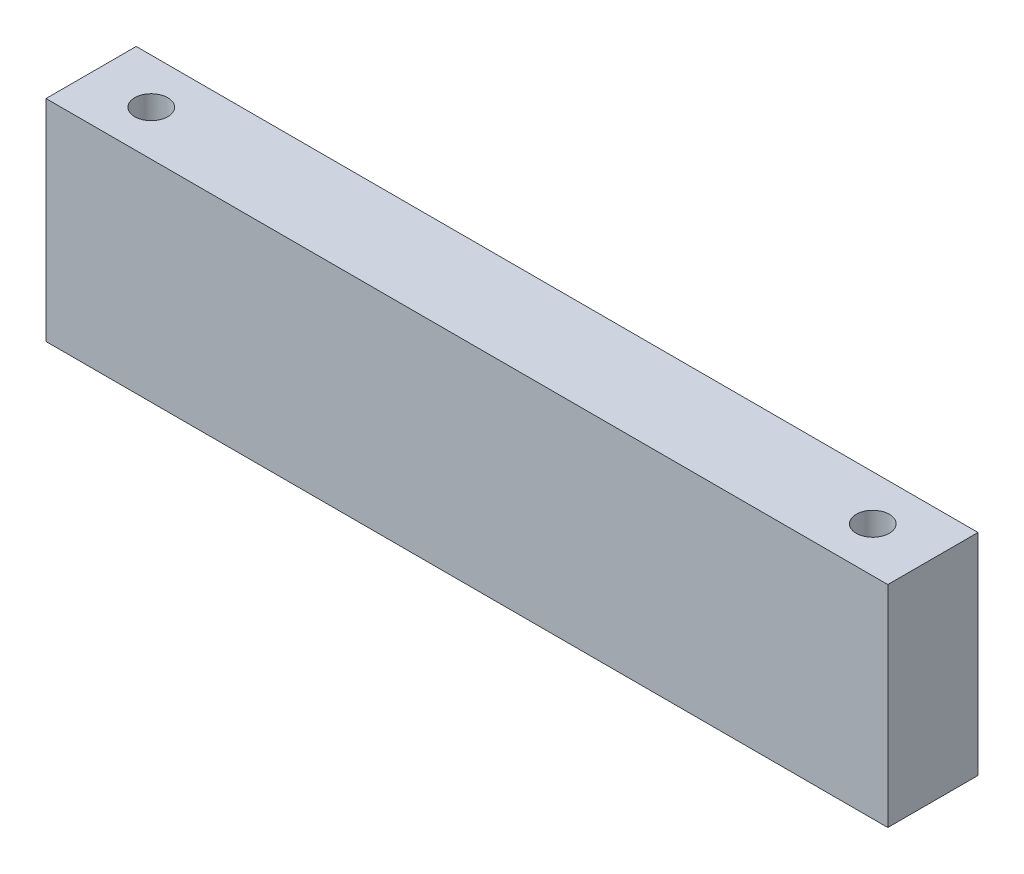
from build123d import *

# Parameters (mm, degrees)
SKETCH1_W           = 280
SKETCH1_H           = 70
BOSS_EXTRUDE1_DEPTH = 30
SKETCH2_R           = 5.5
CUT_EXTRUDE1_DEPTH  = 80


with BuildPart() as part:
    # Sketch1 → Boss-Extrude1 (new body)
    with BuildSketch(Plane.XY):
        Rectangle(SKETCH1_W, SKETCH1_H)
    extrude(amount=BOSS_EXTRUDE1_DEPTH)

    # Sketch2 → Cut-Extrude1 (cut)
    with BuildSketch(Plane(origin=(0, 35, 0), x_dir=(1, 0, 0), z_dir=(0, 1, 0))):
        with Locations(Location((-120, -15, 0), (0, 0, 270))):
            Circle(SKETCH2_R)
        with Locations(Location((120, -15, 0), (0, 0, 270))):
            Circle(SKETCH2_R)
    extrude(amount=-CUT_EXTRUDE1_DEPTH, mode=Mode.SUBTRACT)


solid = part.part
